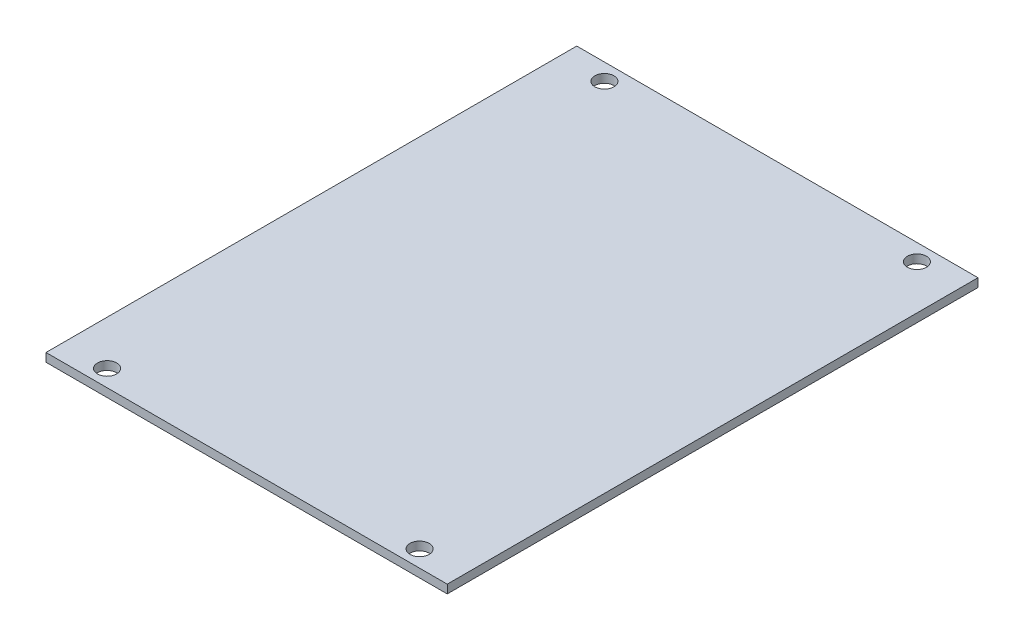
from build123d import *

# Parameters (mm, degrees)
SKETCH1_W           = 71.8566
SKETCH1_H           = 95.0468
BOSS_EXTRUDE1_DEPTH = 1.524
SKETCH2_R           = 1.7145
CUT_EXTRUDE1_DEPTH  = 60.595627897


with BuildPart() as part:
    # Sketch1 → Boss-Extrude1 (new body)
    with BuildSketch(Plane(origin=(0, 0, 0), x_dir=(1, 0, 0), z_dir=(0, 1, 0))):
        Rectangle(SKETCH1_W, SKETCH1_H)
    extrude(amount=BOSS_EXTRUDE1_DEPTH)

    # Sketch2 → Cut-Extrude1 (cut, through all)
    with BuildSketch(Plane(origin=(0, 1.524, 0), x_dir=(1, 0, 0), z_dir=(0, 1, 0))):
        with Locations(Location((-27.981275, 44.53255, 0), (0, 0, 270))):
            Circle(SKETCH2_R)
        with Locations(Location((27.981275, 44.53255, 0), (0, 0, 270))):
            Circle(SKETCH2_R)
        with Locations(Location((27.981275, -44.53255, 0), (0, 0, 270))):
            Circle(SKETCH2_R)
        with Locations(Location((-27.981275, -44.53255, 0), (0, 0, 270))):
            Circle(SKETCH2_R)
    extrude(amount=-CUT_EXTRUDE1_DEPTH, mode=Mode.SUBTRACT)


solid = part.part
